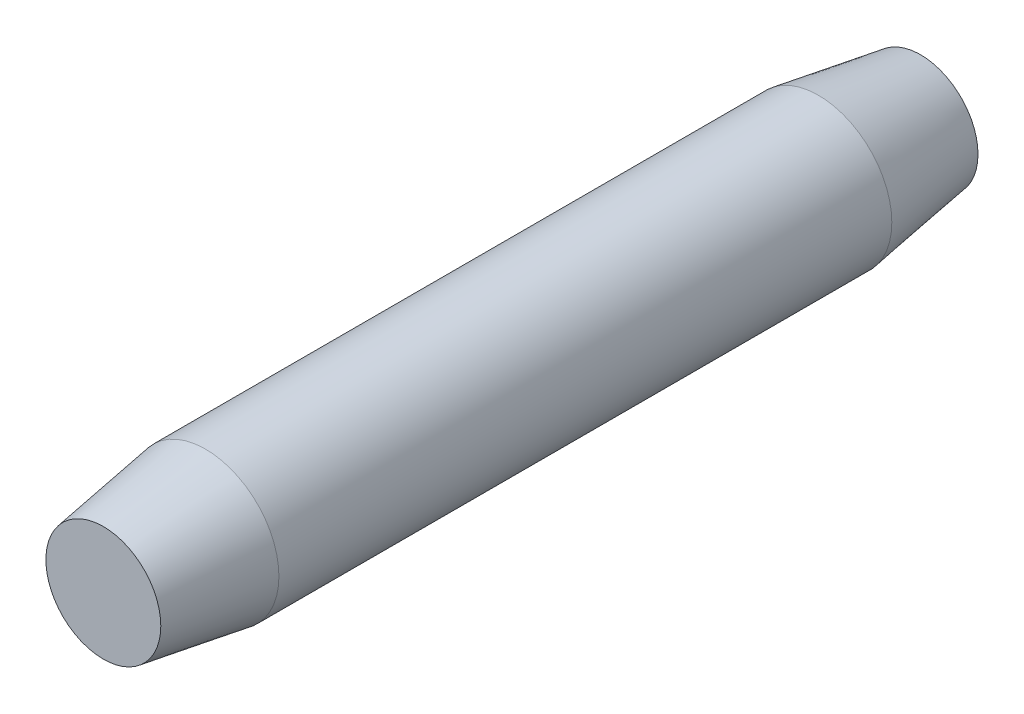
from build123d import *

# Parameters (mm, degrees)
SKETCH1_R           = 18.25625
BOSS_EXTRUDE1_DEPTH = 101.6
CHAMFER1_SIZE       = 25.4
CHAMFER1_SIZE2      = 3.96875
CHAMFER2_SIZE       = 3.96875
CHAMFER2_SIZE2      = 25.4


with BuildPart() as part:
    # Sketch1 → Boss-Extrude1 (new, symmetric)
    with BuildSketch(Plane.XY):
        Circle(SKETCH1_R)
    extrude(amount=BOSS_EXTRUDE1_DEPTH, both=True)

    # Chamfer1
    chamfer1_edges = [part.edges().sort_by_distance(p)[0] for p in [
        (-18.25625, 0, 101.6),
    ]]
    chamfer1_side = [part.faces().sort_by_distance(p)[0] for p in [
        (-18.25625, 0, 0),
    ]]
    chamfer(chamfer1_edges, length=CHAMFER1_SIZE, length2=CHAMFER1_SIZE2, reference=chamfer1_side[0])

    # Chamfer2
    chamfer2_edges = [part.edges().sort_by_distance(p)[0] for p in [
        (-18.25625, 0, -101.6),
    ]]
    chamfer2_side = [part.faces().sort_by_distance(p)[0] for p in [
        (0, 0, -101.6),
    ]]
    chamfer(chamfer2_edges, length=CHAMFER2_SIZE, length2=CHAMFER2_SIZE2, reference=chamfer2_side[0])


solid = part.part
